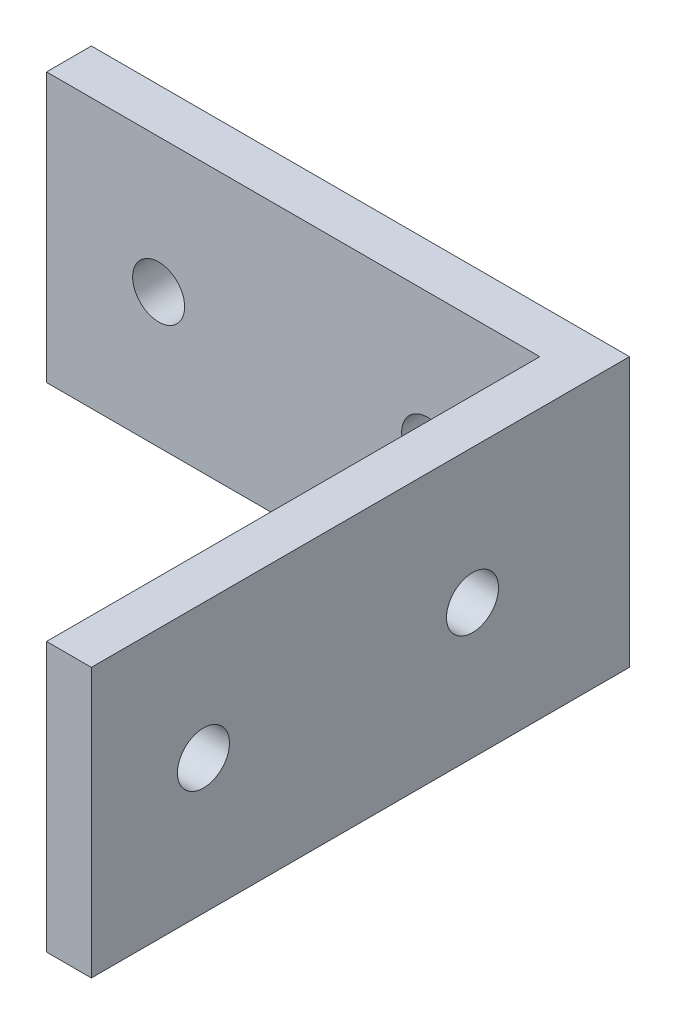
from build123d import *

# Parameters (mm, degrees)
SKETCH1_W           = 76.2
SKETCH1_H           = 76.2
BOSS_EXTRUDE1_DEPTH = 38.1
SKETCH2_OUTSIDE_W   = 101.06
SKETCH2_OUTSIDE_H   = 101.06
CUT_EXTRUDE1_DEPTH  = 66.991135768
CUT_EXTRUDE2_DEPTH  = 38.1
CUT_EXTRUDE3_DEPTH  = 38.1


with BuildPart() as part:
    # Sketch1 → Boss-Extrude1 (new body)
    with BuildSketch(Plane(origin=(0, 0, 0), x_dir=(1, 0, 0), z_dir=(0, 1, 0))):
        Rectangle(SKETCH1_W, SKETCH1_H)
    extrude(amount=BOSS_EXTRUDE1_DEPTH)

    # Sketch2 outside → Cut-Extrude1 (cut, through all)
    with BuildSketch(Plane(origin=(0, 38.1, 0), x_dir=(1, 0, 0), z_dir=(0, 1, 0))):
        Rectangle(SKETCH2_OUTSIDE_W, SKETCH2_OUTSIDE_H)
        Polygon((-38.1, 38.1), (38.1, 38.1), (38.1, 31.75), (38.1, -38.1), (31.75, -38.1), (31.75, 31.75), (-38.1, 31.75), align=None, mode=Mode.SUBTRACT)
    extrude(amount=-CUT_EXTRUDE1_DEPTH, mode=Mode.SUBTRACT)

    # Sketch4 → Cut-Extrude2 (cut)
    with BuildSketch(Plane.XY.offset(-31.75)):
        with BuildLine():
            Line((-25.908, 19.05), (-22.225, 19.05))
            Line((-22.225, 19.05), (-18.542, 19.05))
            ThreePointArc((-18.542, 19.05), (-22.225, 22.733), (-25.908, 19.05))
        make_face()
        with BuildLine():
            Line((-18.542, 19.05), (-22.225, 19.05))
            Line((-22.225, 19.05), (-25.908, 19.05))
            ThreePointArc((-25.908, 19.05), (-22.225, 15.367), (-18.542, 19.05))
        make_face()
        with BuildLine():
            ThreePointArc((19.558, 19.05), (15.875, 22.733), (12.192, 19.05))
            Line((12.192, 19.05), (15.875, 19.05))
            Line((15.875, 19.05), (19.558, 19.05))
        make_face()
        with BuildLine():
            Line((15.875, 19.05), (12.192, 19.05))
            ThreePointArc((12.192, 19.05), (15.875, 15.367), (19.558, 19.05))
            Line((19.558, 19.05), (15.875, 19.05))
        make_face()
    extrude(amount=-CUT_EXTRUDE2_DEPTH, mode=Mode.SUBTRACT)

    # Sketch5 → Cut-Extrude3 (cut)
    with BuildSketch(Plane.ZY.offset(-31.75)):
        with BuildLine():
            Line((-19.558, 19.05), (-15.875, 19.05))
            Line((-15.875, 19.05), (-12.192, 19.05))
            ThreePointArc((-12.192, 19.05), (-15.875, 22.733), (-19.558, 19.05))
        make_face()
        with BuildLine():
            Line((-12.192, 19.05), (-15.875, 19.05))
            Line((-15.875, 19.05), (-19.558, 19.05))
            ThreePointArc((-19.558, 19.05), (-15.875, 15.367), (-12.192, 19.05))
        make_face()
        with BuildLine():
            ThreePointArc((25.908, 19.05), (22.225, 22.733), (18.542, 19.05))
            Line((18.542, 19.05), (22.225, 19.05))
            Line((22.225, 19.05), (25.908, 19.05))
        make_face()
        with BuildLine():
            Line((22.225, 19.05), (18.542, 19.05))
            ThreePointArc((18.542, 19.05), (22.225, 15.367), (25.908, 19.05))
            Line((25.908, 19.05), (22.225, 19.05))
        make_face()
    extrude(amount=-CUT_EXTRUDE3_DEPTH, mode=Mode.SUBTRACT)


solid = part.part
